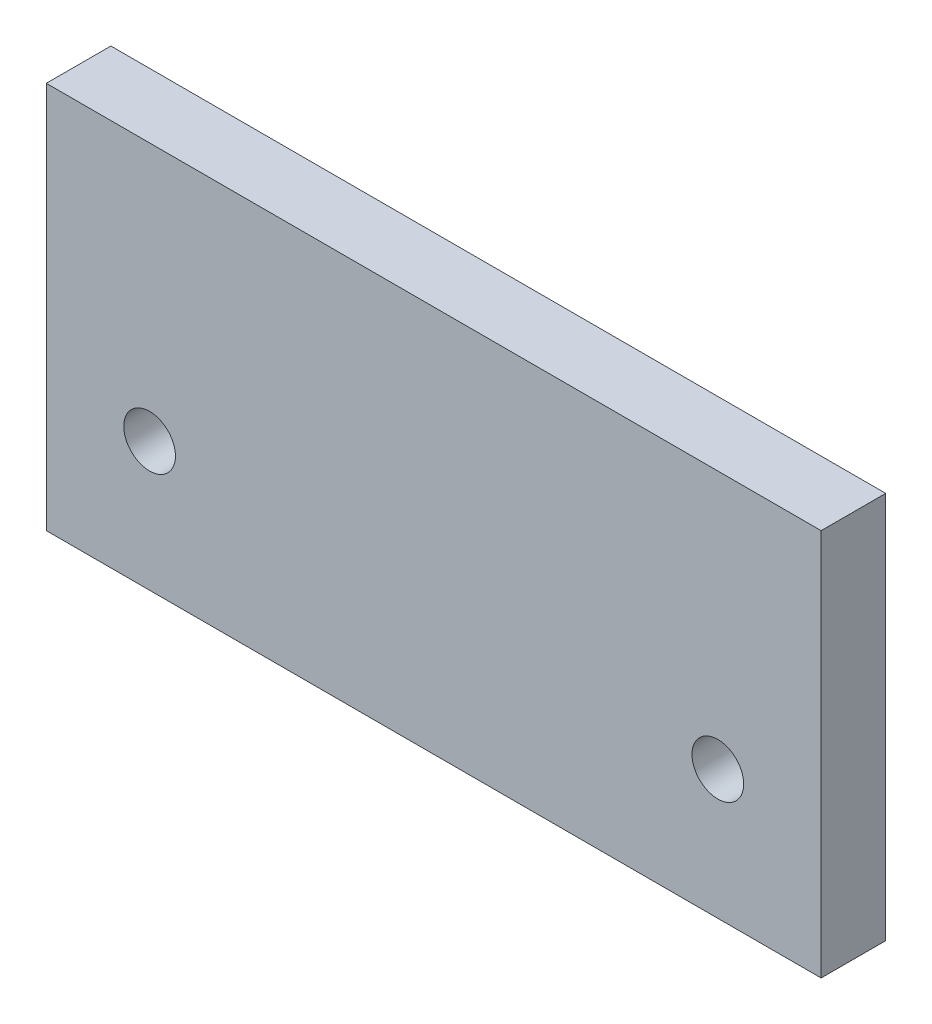
from build123d import *

# Parameters (mm, degrees)
SKETCH1_W           = 60
SKETCH1_H           = 30
SKETCH1_R           = 2
BOSS_EXTRUDE1_DEPTH = 5


with BuildPart() as part:
    # Sketch1 → Boss-Extrude1 (new body)
    with BuildSketch(Plane.XY):
        with Locations((-17.553806785, -6.430644457)):
            Rectangle(SKETCH1_W, SKETCH1_H)
        with Locations((-39.553806785, -11.430644457)):
            Circle(SKETCH1_R, mode=Mode.SUBTRACT)
        with Locations(Location((4.446193215, -11.430644457, 0), (0, 0, 180))):
            Circle(SKETCH1_R, mode=Mode.SUBTRACT)
    extrude(amount=BOSS_EXTRUDE1_DEPTH)


solid = part.part
